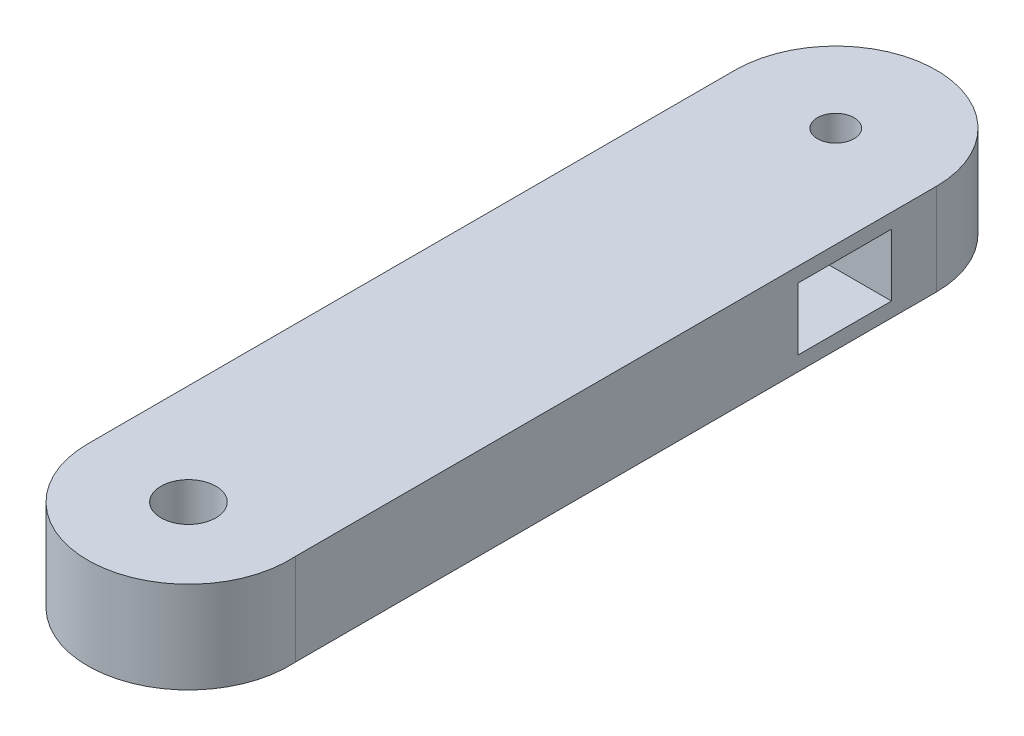
from build123d import *

# Parameters (mm, degrees)
EXTRUDE_START       = -3
EXTRUDE_1_DEPTH     = 3
SKETCH_4_R          = 1
CUT_EXTRUDE_1_DEPTH = 5
EXTRUDE_3_DEPTH     = 2
CUT_EXTRUDE_START   = 10
SKETCH_4_2_R        = 1
CUT_EXTRUDE_2_DEPTH = 10
SKETCH_6_W          = 5.1
SKETCH_6_H          = 3.4
CUT_EXTRUDE_3_DEPTH = 43.585635121


with BuildPart() as part:
    # 草图1 → 旋转1 (revolve)
    with BuildSketch(Plane.XY, mode=Mode.PRIVATE) as revolve_1_sk:
        Polygon((-2.4, 0), (-5.5, 0), (-5.5, 5), (-4.25, 5), (-1.5, 5), (-1.5, 3.8), (-1.5, 2.66), (-1.5, 0), align=None)
    revolve(revolve_1_sk.sketch.rotate(Axis((0, 0, 0), (0, 1, 0)), 270), axis=Axis((0, 0, 0), (0, 1, 0)))

    # 草图2 → 凸台-拉伸1 (add)
    with BuildSketch(Plane(origin=(0, 2, 0), x_dir=(-1, 0, 0), z_dir=(0, -1, 0)).offset(EXTRUDE_START)):
        with BuildLine():
            Line((-5.489247302, 0.34375), (-5.489247302, 35.34375))
            ThreePointArc((-5.489247302, 35.34375), (0.005376349, 40.838373651), (5.5, 35.34375))
            Line((5.5, 35.34375), (5.5, 0))
            ThreePointArc((5.5, 0), (0.171959067, 5.497311168), (-5.489247302, 0.34375))
        make_face()
    extrude(amount=EXTRUDE_1_DEPTH)

    # 草图4 → 切除-拉伸1 (cut, symmetric)
    with BuildSketch(Plane.XZ.offset(-2)):
        with Locations(Location((-0.005376349, -35.34375, 0), (0, 0, 270))):
            Circle(SKETCH_4_R)
    extrude(amount=CUT_EXTRUDE_1_DEPTH, both=True, mode=Mode.SUBTRACT)

    # 草图2<2> → 凸台-拉伸3 (add)
    with BuildSketch(Plane(origin=(0, 2, 0), x_dir=(-1, 0, 0), z_dir=(0, -1, 0))):
        with BuildLine():
            Line((-5.489247302, 0.34375), (-5.489247302, 35.34375))
            ThreePointArc((-5.489247302, 35.34375), (0.005376349, 40.838373651), (5.5, 35.34375))
            Line((5.5, 35.34375), (5.5, 0))
            ThreePointArc((5.5, 0), (0.171959067, 5.497311168), (-5.489247302, 0.34375))
        make_face()
    extrude(amount=EXTRUDE_3_DEPTH)

    # 草图4<2> → 切除-拉伸2 (cut)
    with BuildSketch(Plane.XZ.offset(-2).offset(CUT_EXTRUDE_START)):
        with Locations(Location((-0.005376349, -35.34375, 0), (0, 0, 270))):
            Circle(SKETCH_4_2_R)
    extrude(amount=-CUT_EXTRUDE_2_DEPTH, mode=Mode.SUBTRACT)

    # 草图6 → 切除-拉伸3 (cut, through all)
    with BuildSketch(Plane(origin=(5.489247302, 0, 0), x_dir=(0, 0, -1), z_dir=(1, 0, 0))):
        with Locations((30.34375, 2.5)):
            Rectangle(SKETCH_6_W, SKETCH_6_H)
    extrude(amount=-CUT_EXTRUDE_3_DEPTH, mode=Mode.SUBTRACT)


solid = part.part
